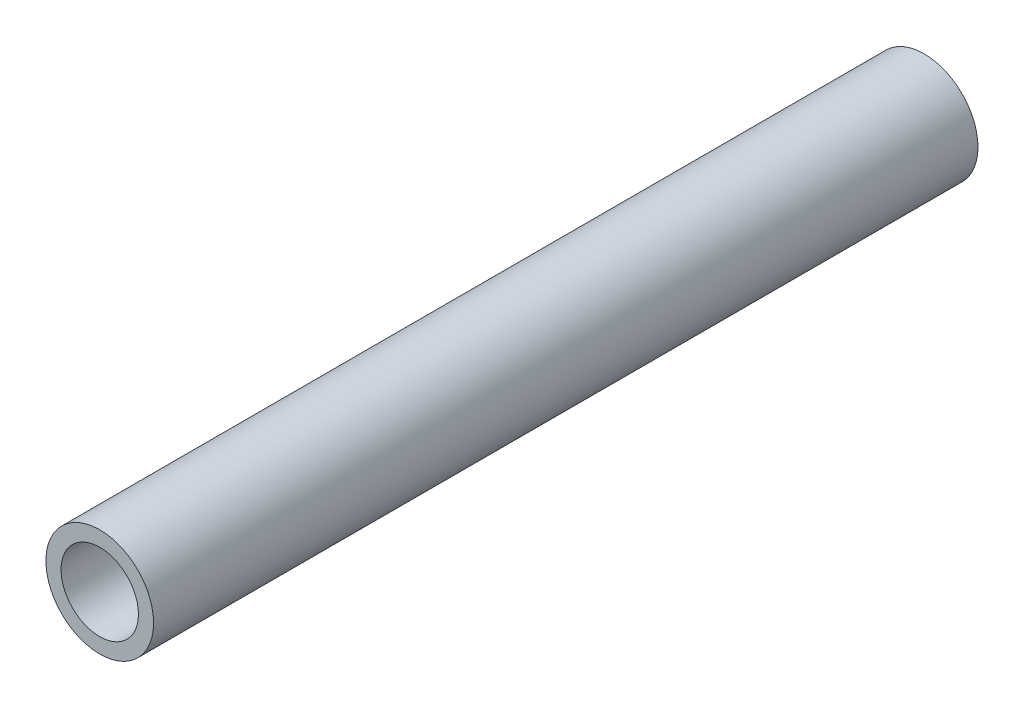
from build123d import *

# Parameters (mm, degrees)
SCHIZZO1_R                = 3.2
SCHIZZO1_R_2              = 2.3
ESTRUSIONE_SOTTILE1_DEPTH = 49


with BuildPart() as part:
    # Schizzo1 → Estrusione-Sottile1 (new body)
    with BuildSketch(Plane.XY):
        Circle(SCHIZZO1_R)
        Circle(SCHIZZO1_R_2, mode=Mode.SUBTRACT)
    extrude(amount=ESTRUSIONE_SOTTILE1_DEPTH)


solid = part.part
